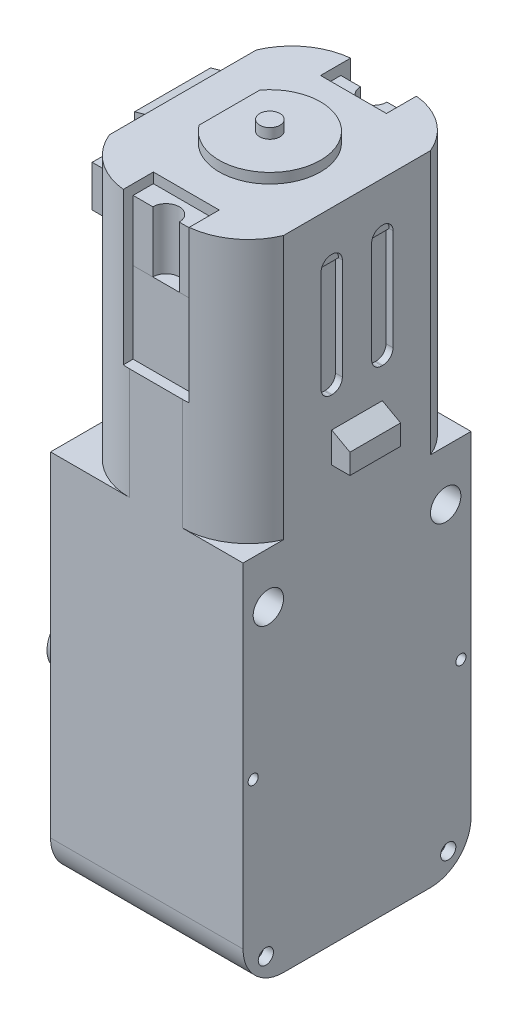
from build123d import *

# Parameters (mm, degrees)
SALIENTE_EXTRUIR2_DEPTH       = 9.5
SALIENTE_EXTRUIR2_DEPTH_BACK  = 9.5
SALIENTE_EXTRUIR4_DEPTH       = 1.3
SALIENTE_EXTRUIR4_DEPTH_BACK  = 1.3
CROQUIS2_W                    = 4.5
CROQUIS2_H                    = 5
CROQUIS2_R                    = 1.5
CROQUIS3_R                    = 2.5
CORTAR_EXTRUIR1_DEPTH         = 5
CROQUIS5_R                    = 0.75
CROQUIS5_R_2                  = 0.5
CORTAR_EXTRUIR2_DEPTH         = 1
CORTAR_EXTRUIR3_START         = -1
CROQUIS4_R                    = 0.5
CROQUIS4_R_2                  = 0.75
CORTAR_EXTRUIR3_DEPTH         = 1
CROQUIS6_R                    = 2
SALIENTE_EXTRUIR6_DEPTH       = 2
CROQUIS7_R                    = 1.5
CORTAR_EXTRUIR4_DEPTH         = 37.97672376
SALIENTE_EXTRUIR7_DEPTH       = 26
CROQUIS9_W                    = 27.483780483
CROQUIS9_H                    = 31.518144496
CORTAR_EXTRUIR5_DEPTH         = 60.879863894
CORTAR_EXTRUIR7_DEPTH         = 60.879863894
CORTAR_EXTRUIR7_DEPTH_BACK    = 60.879863894
CROQUIS11_W                   = 28.397068188
CROQUIS11_H                   = 15.296763251
CROQUIS12_W                   = 22.5
CROQUIS12_H                   = 4.565295285
CROQUIS12_R                   = 1.5
CORTAR_EXTRUIR8_DEPTH         = 60.879863894
CROQUIS14_W                   = 19
CROQUIS14_H                   = 22.5
SALIENTE_EXTRUIR9_DEPTH       = 30
CROQUIS15_R                   = 1.5
CORTAR_EXTRUIR9_DEPTH         = 60.879863894
CROQUIS16_R                   = 2
SALIENTE_EXTRUIR10_DEPTH      = 2
CROQUIS17_R                   = 0.5
CROQUIS17_R_2                 = 0.75
CORTAR_EXTRUIR10_DEPTH        = 60.879863894
CROQUIS20_W                   = 0.773109855
CROQUIS20_H                   = 0.470542453
SALIENTE_EXTRUIR12_DEPTH      = 24
CROQUIS21_W                   = 16.85701041
CROQUIS21_H                   = 22.5
SALIENTE_EXTRUIR13_DEPTH      = 24
CORTAR_EXTRUIR11_DEPTH        = 60.879863894
CORTAR_EXTRUIR12_DEPTH        = 5
CROQUIS23_R                   = 2.75
CROQUIS23_R_2                 = 2.6
SALIENTE_EXTRUIR14_DEPTH      = 0.5
SALIENTE_EXTRUIR14_DRAFT      = 8
CROQUIS24_W                   = 2.5
CROQUIS24_H                   = 5
SALIENTE_EXTRUIR15_DEPTH      = 4.7
CROQUIS25_R                   = 1.4
CORTAR_EXTRUIR13_DEPTH        = 4.7
SALIENTE_EXTRUIR17_DEPTH      = 2
SALIENTE_EXTRUIR17_DEPTH_BACK = 19
CROQUIS26_W                   = 3
CROQUIS26_H                   = 5
CORTAR_EXTRUIR14_DEPTH        = 58.938312885
CORTAR_EXTRUIR14_DEPTH_BACK   = 58.938312885
CORTAR_EXTRUIR15_DEPTH        = 60.879863894
CORTAR_EXTRUIR16_START        = -7
CORTAR_EXTRUIR16_DEPTH        = 7
SALIENTE_EXTRUIR18_DEPTH      = 3.75
SALIENTE_EXTRUIR18_DEPTH_BACK = 3.75
CROQUIS30_W                   = 7.5
CROQUIS30_H                   = 1
CORTAR_EXTRUIR17_DEPTH        = 58.938312885
CORTAR_EXTRUIR17_DEPTH_BACK   = 58.938312885
CROQUIS31_W                   = 5.5
CROQUIS31_H                   = 1.5
CORTAR_EXTRUIR18_DEPTH        = 58.938312885
CORTAR_EXTRUIR18_DEPTH_BACK   = 58.938312885
CORTAR_EXTRUIR22_DEPTH        = 59.781677417
CORTAR_EXTRUIR22_DEPTH_BACK   = 59.781677417
CORTAR_EXTRUIR23_START        = -15
CORTAR_EXTRUIR23_DEPTH        = 15
CORTAR_EXTRUIR24_DEPTH        = 5
CROQUIS37_W                   = 15.777972317
CROQUIS37_H                   = 14.808381702
SALIENTE_EXTRUIR19_DEPTH      = 11
CROQUIS38_W                   = 18.88083152
CROQUIS38_H                   = 4.081408477
SALIENTE_EXTRUIR21_DEPTH      = 1
CROQUIS39_W                   = 9.12350037
CROQUIS39_H                   = 4.081408477
SALIENTE_EXTRUIR23_DEPTH      = 0.6
CROQUIS40_W                   = 6.5
CROQUIS40_H                   = 2
SALIENTE_EXTRUIR24_DEPTH      = 8
SALIENTE_EXTRUIR24_2_DEPTH    = 8
CROQUIS41_R                   = 1
SALIENTE_EXTRUIR26_DEPTH      = 7
SALIENTE_EXTRUIR27_DEPTH      = 6
SALIENTE_EXTRUIR27_2_DEPTH    = 6
SALIENTE_EXTRUIR28_DEPTH      = 6
CROQUIS44_W                   = 5.21443522
CROQUIS44_H                   = 9.574781913
SALIENTE_EXTRUIR29_DEPTH      = 2
CROQUIS46_R                   = 0.697640257
SALIENTE_EXTRUIR32_DEPTH      = 0.4
SALIENTE_EXTRUIR32_2_DEPTH    = 0.4
CROQUIS47_R                   = 2.6
SALIENTE_EXTRUIR33_DEPTH      = 14
CORTAR_EXTRUIR25_DEPTH        = 8
CROQUIS49_R                   = 1
CORTAR_EXTRUIR26_DEPTH        = 8


with BuildPart() as part:
    # Croquis1 → Saliente-Extruir2 (new, two sides: drawn at the far end of the back side and taken through both)
    with BuildSketch(Plane.YZ.offset(-SALIENTE_EXTRUIR2_DEPTH_BACK)):
        with BuildLine():
            Line((-4.84, 11.25), (29.66, 11.25))
            Line((29.66, 11.25), (29.66, -11.25))
            Line((29.66, -11.25), (-4.84, -11.25))
            ThreePointArc((-4.84, -11.25), (-6.607766953, -10.517766953), (-7.34, -8.75))
            Line((-7.34, -8.75), (-7.34, 8.75))
            ThreePointArc((-7.34, 8.75), (-6.607766953, 10.517766953), (-4.84, 11.25))
        make_face()
    extrude(amount=SALIENTE_EXTRUIR2_DEPTH + SALIENTE_EXTRUIR2_DEPTH_BACK)

    # Croquis2 → Saliente-Extruir4 (add, two sides: drawn at the far end of the back side and taken through both)
    with BuildSketch(Plane.YZ.offset(-SALIENTE_EXTRUIR4_DEPTH_BACK)):
        with Locations((-9.59, 0)):
            Rectangle(CROQUIS2_W, CROQUIS2_H)
        with Locations(Location((-9.34, 0, 0), (0, 0, 270))):
            Circle(CROQUIS2_R, mode=Mode.SUBTRACT)
    extrude(amount=SALIENTE_EXTRUIR4_DEPTH + SALIENTE_EXTRUIR4_DEPTH_BACK)

    # Croquis3 → Cortar-Extruir1 (cut)
    with BuildSketch(Plane(origin=(-9.5, 0, 0), x_dir=(0, -1, 0), z_dir=(-1, 0, 0))):
        with Locations(Location((0, 0, 0), (0, 0, 90))):
            Circle(CROQUIS3_R)
    extrude(amount=-CORTAR_EXTRUIR1_DEPTH, mode=Mode.SUBTRACT)

    # Croquis5 → Cortar-Extruir2 (cut)
    with BuildSketch(Plane.YZ.offset(9.5)):
        with Locations(Location((-4.84, 8.75, 0), (0, 0, 270))):
            Circle(CROQUIS5_R)
        with Locations(Location((5.66, 9.75, 0), (0, 0, 270))):
            Circle(CROQUIS5_R_2)
        with Locations(Location((5.66, -9.75, 0), (0, 0, 270))):
            Circle(CROQUIS5_R_2)
        with Locations(Location((-4.84, -8.75, 0), (0, 0, 270))):
            Circle(CROQUIS5_R)
    extrude(amount=-CORTAR_EXTRUIR2_DEPTH, mode=Mode.SUBTRACT)

    # Croquis4 → Cortar-Extruir3 (cut)
    with BuildSketch(Plane.ZY.offset(9.5).offset(CORTAR_EXTRUIR3_START)):
        with Locations(Location((9.75, 5.66, 0), (0, 0, 180))):
            Circle(CROQUIS4_R)
        with Locations(Location((8.75, -4.84, 0), (0, 0, 180))):
            Circle(CROQUIS4_R_2)
        with Locations(Location((-8.75, -4.84, 0), (0, 0, 180))):
            Circle(CROQUIS4_R_2)
        with Locations(Location((-9.75, 5.66, 0), (0, 0, 180))):
            Circle(CROQUIS4_R)
    extrude(amount=CORTAR_EXTRUIR3_DEPTH, mode=Mode.SUBTRACT)

    # Croquis6 → Saliente-Extruir6 (add)
    with BuildSketch(Plane.ZY.offset(9.5)):
        with Locations(Location((0, 10.66, 0), (0, 0, 180))):
            Circle(CROQUIS6_R)
    extrude(amount=SALIENTE_EXTRUIR6_DEPTH)

    # Croquis7 → Cortar-Extruir4 (cut, through all)
    with BuildSketch(Plane.ZY.offset(9.5)):
        with Locations((-8.75, 19.66)):
            Circle(CROQUIS7_R)
        with Locations(Location((8.75, 19.66, 0), (0, 0, 180))):
            Circle(CROQUIS7_R)
    extrude(amount=-CORTAR_EXTRUIR4_DEPTH, mode=Mode.SUBTRACT)

    # Croquis8 → Saliente-Extruir7 (add)
    with BuildSketch(Plane(origin=(0, 29.66, 0), x_dir=(-1, 0, 0), z_dir=(0, 1, 0))):
        with BuildLine():
            Line((-3.5, 11.25), (1.7, 11.25))
            ThreePointArc((1.7, 11.25), (5.305551275, 10.158326913), (7.7, 7.25))
            Line((7.7, 7.25), (7.7, -7.25))
            ThreePointArc((7.7, -7.25), (5.305551275, -10.158326913), (1.7, -11.25))
            Line((1.7, -11.25), (-3.5, -11.25))
            ThreePointArc((-3.5, -11.25), (-7.105551275, -10.158326913), (-9.5, -7.25))
            Line((-9.5, -7.25), (-9.5, 7.25))
            ThreePointArc((-9.5, 7.25), (-7.105551275, 10.158326913), (-3.5, 11.25))
        make_face()
    extrude(amount=SALIENTE_EXTRUIR7_DEPTH)

    # Croquis9 → Cortar-Extruir5 (cut, through all)
    with BuildSketch(Plane(origin=(-9.5, 0, 0), x_dir=(0, -1, 0), z_dir=(-1, 0, 0))):
        with Locations((5.081890242, -0.401551564)):
            Rectangle(CROQUIS9_W, CROQUIS9_H)
    extrude(amount=-CORTAR_EXTRUIR5_DEPTH, mode=Mode.SUBTRACT)

    # Croquis11 → Cortar-Extruir7 (cut, two sides: drawn at the far end of the back side and taken through both)
    with BuildSketch(Plane.ZY.offset(9.5).offset(-CORTAR_EXTRUIR7_DEPTH_BACK)):
        with Locations((-0.835139934, 10.44632309)):
            Rectangle(CROQUIS11_W, CROQUIS11_H)
    extrude(amount=CORTAR_EXTRUIR7_DEPTH + CORTAR_EXTRUIR7_DEPTH_BACK, mode=Mode.SUBTRACT)

    # Croquis12 → Cortar-Extruir8 (cut, through all)
    # profile 1 of 2: a face of its own
    with BuildSketch(Plane.ZY.offset(9.5)):
        with Locations((0, 20.377352358)):
            Rectangle(CROQUIS12_W, CROQUIS12_H)
        with Locations((-8.75, 19.66)):
            Circle(CROQUIS12_R, mode=Mode.SUBTRACT)
        with Locations((8.75, 19.66)):
            Circle(CROQUIS12_R, mode=Mode.SUBTRACT)
    # profile 2 of 2: a face of its own
    with BuildSketch(Plane.ZY.offset(9.5)):
        Polygon((12.104698513, 22.66), (11.25, 22.66), (11.25, 18.094704715), (-11.25, 18.094704715), (-11.25, 15.490950766), (12.104698513, 15.490950766), align=None)
    extrude(amount=-CORTAR_EXTRUIR8_DEPTH, mode=Mode.SUBTRACT)

    # Croquis14 → Saliente-Extruir9 (add)
    with BuildSketch(Plane(origin=(0, 22.66, 0), x_dir=(-1, 0, 0), z_dir=(0, -1, 0))):
        Rectangle(CROQUIS14_W, CROQUIS14_H)
    extrude(amount=SALIENTE_EXTRUIR9_DEPTH)

    # Croquis15 → Cortar-Extruir9 (cut, through all)
    with BuildSketch(Plane.ZY.offset(9.5)):
        with Locations((8.75, 24.66)):
            Circle(CROQUIS15_R)
        with Locations((-8.75, 24.66)):
            Circle(CROQUIS15_R)
    extrude(amount=-CORTAR_EXTRUIR9_DEPTH, mode=Mode.SUBTRACT)

    # Croquis16 → Saliente-Extruir10 (add)
    with BuildSketch(Plane.ZY.offset(9.5)):
        with Locations(Location((0, 15.66, 0), (0, 0, 180))):
            Circle(CROQUIS16_R)
    extrude(amount=SALIENTE_EXTRUIR10_DEPTH)

    # Croquis17 → Cortar-Extruir10 (cut, through all)
    with BuildSketch(Plane.ZY.offset(9.5)):
        with Locations((10.25, 10.66)):
            Circle(CROQUIS17_R)
        with BuildLine():
            ThreePointArc((9.530330086, -5.620330086), (9.692909649, -5.377012574), (9.75, -5.09))
            ThreePointArc((9.75, -5.09), (9.287012574, -4.397090351), (8.469669914, -4.559669914))
            Line((8.469669914, -4.559669914), (9.530330086, -5.620330086))
        make_face()
        with BuildLine():
            Line((9.530330086, -5.620330086), (8.469669914, -4.559669914))
            ThreePointArc((8.469669914, -4.559669914), (8.469669914, -5.620330086), (9.530330086, -5.620330086))
        make_face()
        with Locations((-10.25, 10.66)):
            Circle(CROQUIS17_R)
        with Locations(Location((-9, -5.09, 0), (0, 0, 180))):
            Circle(CROQUIS17_R_2)
    extrude(amount=-CORTAR_EXTRUIR10_DEPTH, mode=Mode.SUBTRACT)

    # Croquis20 → Saliente-Extruir12 (add)
    with BuildSketch(Plane.XZ.offset(7.34)):
        with Locations((2.429452283, 4.566914846)):
            Rectangle(CROQUIS20_W, CROQUIS20_H)
    extrude(amount=-SALIENTE_EXTRUIR12_DEPTH)

    # Croquis21 → Saliente-Extruir13 (add)
    with BuildSketch(Plane(origin=(0, -7.34, 0), x_dir=(-1, 0, 0), z_dir=(0, -1, 0))):
        with Locations((-0.10132468, 0)):
            Rectangle(CROQUIS21_W, CROQUIS21_H)
    extrude(amount=-SALIENTE_EXTRUIR13_DEPTH)

    # Croquis19 → Cortar-Extruir11 (cut, through all)
    with BuildSketch(Plane.ZY.offset(9.5)):
        with BuildLine():
            Line((7.25, -7.34), (11.25, -7.34))
            Line((11.25, -7.34), (11.25, -3.34))
            ThreePointArc((11.25, -3.34), (10.078427125, -6.168427125), (7.25, -7.34))
        make_face()
        with BuildLine():
            Line((-11.25, -7.34), (-7.25, -7.34))
            ThreePointArc((-7.25, -7.34), (-10.078427125, -6.168427125), (-11.25, -3.34))
            Line((-11.25, -3.34), (-11.25, -7.34))
        make_face()
    extrude(amount=-CORTAR_EXTRUIR11_DEPTH, mode=Mode.SUBTRACT)

    # Croquis22 → Cortar-Extruir12 (cut)
    with BuildSketch(Plane.ZY.offset(9.5)):
        with BuildLine():
            ThreePointArc((-2.6, 3.86), (0, 1.26), (2.6, 3.86))
            Line((2.6, 3.86), (-2.6, 3.86))
        make_face()
        with BuildLine():
            Line((-2.6, 3.86), (2.6, 3.86))
            ThreePointArc((2.6, 3.86), (0, 6.46), (-2.6, 3.86))
        make_face()
    extrude(amount=-CORTAR_EXTRUIR12_DEPTH, mode=Mode.SUBTRACT)


with BuildPart() as saliente_extruir14_tool:
    # Croquis23 → Saliente-Extruir14 (with draft: the straight prism first)
    with BuildSketch(Plane.ZY.offset(9.5)):
        with Locations((0, 3.86)):
            Circle(CROQUIS23_R)
        with Locations((0, 3.86)):
            Circle(CROQUIS23_R_2, mode=Mode.SUBTRACT)
    extrude(amount=SALIENTE_EXTRUIR14_DEPTH)
    # Saliente-Extruir14: the draft: its side faces are tilted about the plane it starts from
    saliente_extruir14_sides = [saliente_extruir14_tool.faces().sort_by_distance(p)[0] for p in [
        (-9.75, 3.86, -2.75),
        (-9.75, 3.86, -2.6),
    ]]
    draft(saliente_extruir14_sides, Plane.ZY.offset(9.5), SALIENTE_EXTRUIR14_DRAFT)


with BuildPart() as part_1:
    add(part.part)

    # Saliente-Extruir14: add saliente_extruir14_tool
    add(saliente_extruir14_tool.part)

    # Croquis24 → Saliente-Extruir15 (add)
    with BuildSketch(Plane.XZ.offset(7.34)):
        Rectangle(CROQUIS24_W, CROQUIS24_H)
    extrude(amount=SALIENTE_EXTRUIR15_DEPTH)

    # Croquis25 → Cortar-Extruir13 (cut)
    with BuildSketch(Plane.ZY.offset(1.25)):
        with Locations((0, -9.64)):
            Circle(CROQUIS25_R)
    extrude(amount=-CORTAR_EXTRUIR13_DEPTH, mode=Mode.SUBTRACT)

    # Croquis26 → Saliente-Extruir17 (add, two sides: drawn at the far end of the back side and taken through both)
    with BuildSketch(Plane(origin=(-7.7, 0, 0), x_dir=(0, -1, 0), z_dir=(-1, 0, 0)).offset(-SALIENTE_EXTRUIR17_DEPTH_BACK)):
        with Locations((-35.16, 0)):
            Rectangle(CROQUIS26_W, CROQUIS26_H)
    extrude(amount=SALIENTE_EXTRUIR17_DEPTH + SALIENTE_EXTRUIR17_DEPTH_BACK)

    # Croquis27 → Cortar-Extruir14 (cut, two sides: drawn at the far end of the back side and taken through both)
    with BuildSketch(Plane(origin=(0, 0, 0), x_dir=(0, 1, 0), z_dir=(0, 0, 1)).offset(-CORTAR_EXTRUIR14_DEPTH_BACK)):
        Polygon((36.66, 7.7), (36.66, 9.7), (35.66, 9.7), align=None)
        Polygon((36.66, -11.3), (35.66, -11.3), (36.66, -9.5), align=None)
    extrude(amount=CORTAR_EXTRUIR14_DEPTH + CORTAR_EXTRUIR14_DEPTH_BACK, mode=Mode.SUBTRACT)

    # Croquis28 → Cortar-Extruir15 (cut, through all)
    with BuildSketch(Plane(origin=(-7.7, 0, 0), x_dir=(0, -1, 0), z_dir=(-1, 0, 0))):
        with BuildLine():
            Line((-46.66, 2.446465015), (-46.66, 2.553534985))
            ThreePointArc((-46.66, 2.553534985), (-46.367106781, 3.260641766), (-45.66, 3.553534985))
            Line((-45.66, 3.553534985), (-40.66, 3.553534985))
            ThreePointArc((-40.66, 3.553534985), (-39.952893219, 3.260641766), (-39.66, 2.553534985))
            Line((-39.66, 2.553534985), (-39.66, 2.446465015))
            ThreePointArc((-39.66, 2.446465015), (-39.952893219, 1.739358234), (-40.66, 1.446465015))
            Line((-40.66, 1.446465015), (-45.66, 1.446465015))
            ThreePointArc((-45.66, 1.446465015), (-46.367106781, 1.739358234), (-46.66, 2.446465015))
        make_face()
        with BuildLine():
            Line((-45.66, -1.446465015), (-40.66, -1.446465015))
            ThreePointArc((-40.66, -1.446465015), (-39.952893219, -1.739358234), (-39.66, -2.446465015))
            Line((-39.66, -2.446465015), (-39.66, -2.553534985))
            ThreePointArc((-39.66, -2.553534985), (-39.952893219, -3.260641766), (-40.66, -3.553534985))
            Line((-40.66, -3.553534985), (-45.66, -3.553534985))
            ThreePointArc((-45.66, -3.553534985), (-46.367106781, -3.260641766), (-46.66, -2.553534985))
            Line((-46.66, -2.553534985), (-46.66, -2.446465015))
            ThreePointArc((-46.66, -2.446465015), (-46.367106781, -1.739358234), (-45.66, -1.446465015))
        make_face()
    extrude(amount=-CORTAR_EXTRUIR15_DEPTH, mode=Mode.SUBTRACT)

    # Croquis29 → Cortar-Extruir16 (cut)
    with BuildSketch(Plane.YZ.offset(9.5).offset(CORTAR_EXTRUIR16_START)):
        with BuildLine():
            Line((50.66, 3.553534985), (45.66, 3.553534985))
            ThreePointArc((45.66, 3.553534985), (46.367106781, 3.260641766), (46.66, 2.553534985))
            Line((46.66, 2.553534985), (46.66, 2.446465015))
            ThreePointArc((46.66, 2.446465015), (46.367106781, 1.739358234), (45.66, 1.446465015))
            Line((45.66, 1.446465015), (50.66, 1.446465015))
            ThreePointArc((50.66, 1.446465015), (51.367106781, 1.739358234), (51.66, 2.446465015))
            Line((51.66, 2.446465015), (51.66, 2.553534985))
            ThreePointArc((51.66, 2.553534985), (51.367106781, 3.260641766), (50.66, 3.553534985))
        make_face()
        with BuildLine():
            Line((50.66, -1.446465015), (45.66, -1.446465015))
            ThreePointArc((45.66, -1.446465015), (46.367106781, -1.739358234), (46.66, -2.446465015))
            Line((46.66, -2.446465015), (46.66, -2.553534985))
            ThreePointArc((46.66, -2.553534985), (46.367106781, -3.260641766), (45.66, -3.553534985))
            Line((45.66, -3.553534985), (50.66, -3.553534985))
            ThreePointArc((50.66, -3.553534985), (51.367106781, -3.260641766), (51.66, -2.553534985))
            Line((51.66, -2.553534985), (51.66, -2.446465015))
            ThreePointArc((51.66, -2.446465015), (51.367106781, -1.739358234), (50.66, -1.446465015))
        make_face()
    extrude(amount=CORTAR_EXTRUIR16_DEPTH, mode=Mode.SUBTRACT)

    # Croquis30 → Saliente-Extruir18 (add, two sides: drawn at the far end of the back side and taken through both)
    with BuildSketch(Plane(origin=(0, 0, 0), x_dir=(0, 1, 0), z_dir=(0, 0, 1)).offset(-SALIENTE_EXTRUIR18_DEPTH_BACK)):
        with Locations((51.91, 8.2)):
            Rectangle(CROQUIS30_W, CROQUIS30_H)
    extrude(amount=SALIENTE_EXTRUIR18_DEPTH + SALIENTE_EXTRUIR18_DEPTH_BACK)

    # Croquis31 → Cortar-Extruir17 (cut, two sides: drawn at the far end of the back side and taken through both)
    with BuildSketch(Plane(origin=(0, 0, 0), x_dir=(0, 1, 0), z_dir=(0, 0, 1)).offset(-CORTAR_EXTRUIR17_DEPTH_BACK)):
        with Locations((51.91, 6.95)):
            Rectangle(CROQUIS31_W, CROQUIS31_H)
    extrude(amount=CORTAR_EXTRUIR17_DEPTH + CORTAR_EXTRUIR17_DEPTH_BACK, mode=Mode.SUBTRACT)

    # Croquis32 → Cortar-Extruir18 (cut, two sides: drawn at the far end of the back side and taken through both)
    with BuildSketch(Plane(origin=(0, 0, 0), x_dir=(0, 1, 0), z_dir=(0, 0, 1)).offset(-CORTAR_EXTRUIR18_DEPTH_BACK)):
        Polygon((48.16, 7.7), (48.16, 8.7), (48.926036623, 8.7), align=None)
    extrude(amount=CORTAR_EXTRUIR18_DEPTH + CORTAR_EXTRUIR18_DEPTH_BACK, mode=Mode.SUBTRACT)

    # Croquis33 → Cortar-Extruir22 (cut, two sides: drawn at the far end of the back side and taken through both)
    with BuildSketch(Plane.XY.offset(3.75).offset(-CORTAR_EXTRUIR22_DEPTH_BACK)):
        Polygon((-8.7, 55.386723755), (-7.7, 55.66), (-8.7, 55.66), align=None)
    extrude(amount=CORTAR_EXTRUIR22_DEPTH + CORTAR_EXTRUIR22_DEPTH_BACK, mode=Mode.SUBTRACT)

    # Croquis34 → Cortar-Extruir23 (cut)
    with BuildSketch(Plane(origin=(0, 55.66, 0), x_dir=(1, 0, 0), z_dir=(0, 1, 0)).offset(CORTAR_EXTRUIR23_START)):
        with BuildLine():
            Line((0.9, -11.25), (3.5, -11.25))
            ThreePointArc((3.5, -11.25), (3.825408038, -11.241849475), (4.15, -11.217418341))
            Line((4.15, -11.217418341), (4.15, -8.25))
            Line((4.15, -8.25), (-2.35, -8.25))
            Line((-2.35, -8.25), (-2.35, -11.217418341))
            ThreePointArc((-2.35, -11.217418341), (-2.025408038, -11.241849475), (-1.7, -11.25))
            Line((-1.7, -11.25), (0.9, -11.25))
        make_face()
        with BuildLine():
            ThreePointArc((4.15, 11.217418341), (3.825408038, 11.241849475), (3.5, 11.25))
            Line((3.5, 11.25), (-1.7, 11.25))
            ThreePointArc((-1.7, 11.25), (-2.025408038, 11.241849475), (-2.35, 11.217418341))
            Line((-2.35, 11.217418341), (-2.35, 8.25))
            Line((-2.35, 8.25), (4.15, 8.25))
            Line((4.15, 8.25), (4.15, 11.217418341))
        make_face()
    extrude(amount=CORTAR_EXTRUIR23_DEPTH, mode=Mode.SUBTRACT)

    # Croquis35 → Cortar-Extruir24 (cut)
    with BuildSketch(Plane(origin=(0, 55.66, 0), x_dir=(-1, 0, 0), z_dir=(0, 1, 0))):
        with BuildLine():
            ThreePointArc((3.1, 3), (-2.48113883, 4.74341649), (-5.9, 0))
            Line((-5.9, 0), (3.1, 0))
            Line((3.1, 0), (3.1, 3))
        make_face()
        with BuildLine():
            Line((3.1, 0), (-5.9, 0))
            ThreePointArc((-5.9, 0), (-2.48113883, -4.74341649), (3.1, -3))
            Line((3.1, -3), (3.1, 0))
        make_face()
    extrude(amount=-CORTAR_EXTRUIR24_DEPTH, mode=Mode.SUBTRACT)


with BuildPart() as body_2:
    # Croquis37 → Saliente-Extruir19 (new body)
    with BuildSketch(Plane(origin=(0, 39.66, 0), x_dir=(1, 0, 0), z_dir=(0, 1, 0))):
        with Locations((0.922815991, 0.584105791)):
            Rectangle(CROQUIS37_W, CROQUIS37_H)
    extrude(amount=SALIENTE_EXTRUIR19_DEPTH)


with BuildPart() as body_3:
    # Croquis38 → Saliente-Extruir21 (new body)
    with BuildSketch(Plane.ZY.offset(6.2)):
        with Locations((0, 52.619295761)):
            Rectangle(CROQUIS38_W, CROQUIS38_H)
    extrude(amount=SALIENTE_EXTRUIR21_DEPTH)


with BuildPart() as body_4:
    # Croquis39 → Saliente-Extruir23 (new body)
    with BuildSketch(Plane.ZY.offset(7.2)):
        with Locations((-0.017583208, 52.619295761)):
            Rectangle(CROQUIS39_W, CROQUIS39_H)
    extrude(amount=SALIENTE_EXTRUIR23_DEPTH)


with BuildPart() as body_5:
    # Croquis40 → Saliente-Extruir24 (new body)
    with BuildSketch(Plane(origin=(0, 40.66, 0), x_dir=(-1, 0, 0), z_dir=(0, 1, 0))):
        with Locations((-0.9, 9.25)):
            Rectangle(CROQUIS40_W, CROQUIS40_H)
    extrude(amount=SALIENTE_EXTRUIR24_DEPTH)


with BuildPart() as body_6:
    # Croquis40 → Saliente-Extruir24 2 (new body)
    with BuildSketch(Plane(origin=(0, 40.66, 0), x_dir=(-1, 0, 0), z_dir=(0, 1, 0))):
        with Locations((-0.9, -9.25)):
            Rectangle(CROQUIS40_W, CROQUIS40_H)
    extrude(amount=SALIENTE_EXTRUIR24_2_DEPTH)


with BuildPart() as body_7:
    # Croquis41 → Saliente-Extruir26 (new body)
    with BuildSketch(Plane(origin=(0, 50.66, 0), x_dir=(1, 0, 0), z_dir=(0, 1, 0))):
        with Locations(Location((0.9, 0, 0), (0, 0, 270))):
            Circle(CROQUIS41_R)
    extrude(amount=SALIENTE_EXTRUIR26_DEPTH)


with BuildPart() as body_8:
    # Croquis42 → Saliente-Extruir27 (new body)
    with BuildSketch(Plane(origin=(0, 48.66, 0), x_dir=(1, 0, 0), z_dir=(0, 1, 0))):
        with BuildLine():
            Line((4.15, -8.25), (-2.35, -8.25))
            Line((-2.35, -8.25), (-2.35, -10.25))
            Line((-2.35, -10.25), (-0.405896925, -10.25))
            ThreePointArc((-0.405896925, -10.25), (0.9, -8.944103075), (2.205896925, -10.25))
            Line((2.205896925, -10.25), (4.15, -10.25))
            Line((4.15, -10.25), (4.15, -8.25))
        make_face()
    extrude(amount=SALIENTE_EXTRUIR27_DEPTH)


with BuildPart() as body_9:
    # Croquis42 → Saliente-Extruir27 2 (new body)
    with BuildSketch(Plane(origin=(0, 48.66, 0), x_dir=(1, 0, 0), z_dir=(0, 1, 0))):
        with BuildLine():
            Line((2.205896925, 10.25), (4.15, 10.25))
            Line((4.15, 10.25), (4.15, 8.25))
            Line((4.15, 8.25), (-2.35, 8.25))
            Line((-2.35, 8.25), (-2.35, 10.25))
            Line((-2.35, 10.25), (-0.405896925, 10.25))
            ThreePointArc((-0.405896925, 10.25), (0.9, 8.944103075), (2.205896925, 10.25))
        make_face()
    extrude(amount=SALIENTE_EXTRUIR27_2_DEPTH)


with BuildPart() as body_10:
    # Croquis43 → Saliente-Extruir28 (new body)
    with BuildSketch(Plane(origin=(0, 50.66, 0), x_dir=(1, 0, 0), z_dir=(0, 1, 0))):
        with BuildLine():
            Line((-3.1, -3), (-3.1, 3))
            ThreePointArc((-3.1, 3), (5.9, 0), (-3.1, -3))
        make_face()
    extrude(amount=SALIENTE_EXTRUIR28_DEPTH)


with BuildPart() as body_11:
    # Croquis44 → Saliente-Extruir29 (new body)
    with BuildSketch(Plane(origin=(0, 50.66, 0), x_dir=(1, 0, 0), z_dir=(0, 1, 0))):
        with Locations((6.50794808, -0.067428042)):
            Rectangle(CROQUIS44_W, CROQUIS44_H)
    extrude(amount=SALIENTE_EXTRUIR29_DEPTH)


with BuildPart() as body_12:
    # Croquis46 → Saliente-Extruir32 (new body)
    with BuildSketch(Plane.ZY.offset(7.2)):
        with BuildLine():
            ThreePointArc((7.197491621, 53.779002545), (7.904598402, 53.486109326), (8.197491621, 52.779002545))
            Line((8.197491621, 52.779002545), (8.197491621, 52.459588978))
            ThreePointArc((8.197491621, 52.459588978), (7.904598402, 51.752482197), (7.197491621, 51.459588978))
            Line((7.197491621, 51.459588978), (4.544166977, 51.459588978))
            Line((4.544166977, 51.459588978), (4.544166977, 53.779002545))
            Line((4.544166977, 53.779002545), (7.197491621, 53.779002545))
        make_face()
        with Locations((7.197491621, 52.619295761)):
            Circle(CROQUIS46_R, mode=Mode.SUBTRACT)
    extrude(amount=SALIENTE_EXTRUIR32_DEPTH)


with BuildPart() as body_13:
    # Croquis46 → Saliente-Extruir32 2 (new body)
    with BuildSketch(Plane.ZY.offset(7.2)):
        with BuildLine():
            Line((-4.544166977, 53.779002545), (-7.197491621, 53.779002545))
            ThreePointArc((-7.197491621, 53.779002545), (-7.904598402, 53.486109326), (-8.197491621, 52.779002545))
            Line((-8.197491621, 52.779002545), (-8.197491621, 52.459588978))
            ThreePointArc((-8.197491621, 52.459588978), (-7.904598402, 51.752482197), (-7.197491621, 51.459588978))
            Line((-7.197491621, 51.459588978), (-4.544166977, 51.459588978))
            Line((-4.544166977, 51.459588978), (-4.544166977, 53.779002545))
        make_face()
        with Locations((-7.197491621, 52.619295761)):
            Circle(CROQUIS46_R, mode=Mode.SUBTRACT)
    extrude(amount=SALIENTE_EXTRUIR32_2_DEPTH)


with BuildPart() as body_14:
    # Croquis47 → Saliente-Extruir33 (new body)
    with BuildSketch(Plane.ZY.offset(4.5)):
        with Locations((0, 3.86)):
            Circle(CROQUIS47_R)
    extrude(amount=SALIENTE_EXTRUIR33_DEPTH)

    # Croquis48 → Cortar-Extruir25 (cut)
    with BuildSketch(Plane.ZY.offset(18.5)):
        with BuildLine():
            Line((-1.922888452, 5.61), (0, 5.61))
            Line((0, 5.61), (1.922888452, 5.61))
            ThreePointArc((1.922888452, 5.61), (0, 6.46), (-1.922888452, 5.61))
        make_face()
        with BuildLine():
            Line((1.922888452, 2.11), (0, 2.11))
            Line((0, 2.11), (-1.922888452, 2.11))
            ThreePointArc((-1.922888452, 2.11), (0, 1.26), (1.922888452, 2.11))
        make_face()
    extrude(amount=-CORTAR_EXTRUIR25_DEPTH, mode=Mode.SUBTRACT)

    # Croquis49 → Cortar-Extruir26 (cut)
    with BuildSketch(Plane.ZY.offset(18.5)):
        with Locations((0, 3.86)):
            Circle(CROQUIS49_R)
    extrude(amount=-CORTAR_EXTRUIR26_DEPTH, mode=Mode.SUBTRACT)


solid = Compound([part_1.part, body_2.part, body_3.part, body_4.part, body_5.part, body_6.part, body_7.part, body_8.part, body_9.part, body_10.part, body_11.part, body_12.part, body_13.part, body_14.part])
